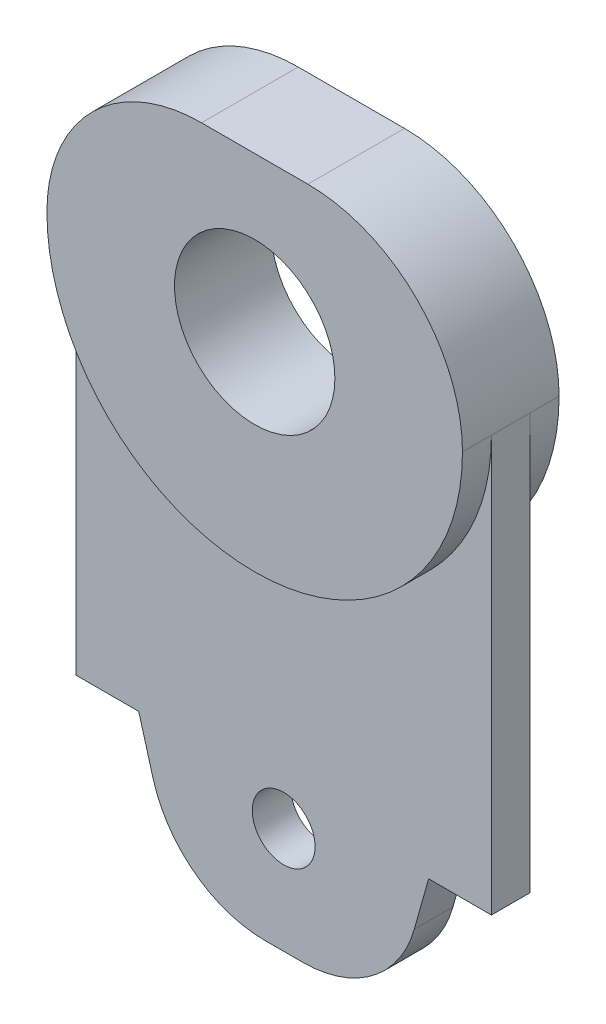
from build123d import *

# Parameters (mm, degrees)
ESQUISSE1_R             = 4.15
ESQUISSE1_R_2           = 1.625
BOSS_EXTRU_1_DEPTH      = 2
SALIENTE_EXTRUIR1_START = -1.5
CROQUIS1_R              = 4.15
SALIENTE_EXTRUIR1_DEPTH = 1.5


with BuildPart() as part:
    # Esquisse1 → Boss.-Extru.1 (new body)
    with BuildSketch(Plane.XY):
        with BuildLine():
            Line((3.25, 0), (3.991824339, -2.629250822))
            ThreePointArc((3.991824339, -2.629250822), (6.145300464, -5.784114596), (9.766384215, -7))
            Line((9.766384215, -7), (11.733615785, -7))
            ThreePointArc((11.733615785, -7), (15.354699536, -5.784114596), (17.508175661, -2.629250822))
            Line((17.508175661, -2.629250822), (18.25, 0))
            Line((18.25, 0), (21.5, 0))
            Line((21.5, 0), (21.5, 21.5))
            ThreePointArc((21.5, 21.5), (19.156854249, 27.156854249), (13.5, 29.5))
            Line((13.5, 29.5), (8, 29.5))
            ThreePointArc((8, 29.5), (2.343145751, 27.156854249), (0, 21.5))
            Line((0, 21.5), (0, 0))
            Line((0, 0), (3.25, 0))
        make_face()
        with Locations((10.75, 21.5)):
            Circle(ESQUISSE1_R, mode=Mode.SUBTRACT)
        with Locations((10.75, -1.5)):
            Circle(ESQUISSE1_R_2, mode=Mode.SUBTRACT)
    extrude(amount=BOSS_EXTRU_1_DEPTH)

    # Croquis1 → Saliente-Extruir1 (add)
    with BuildSketch(Plane.XY.offset(SALIENTE_EXTRUIR1_START)):
        with BuildLine():
            ThreePointArc((0, 21.5), (3.148602144, 13.898602061), (10.750000117, 10.75))
            ThreePointArc((10.750000117, 10.75), (18.351397939, 13.898602144), (21.5, 21.5))
            ThreePointArc((21.5, 21.5), (19.156854249, 27.156854249), (13.5, 29.5))
            Line((13.5, 29.5), (8, 29.5))
            ThreePointArc((8, 29.5), (2.343145751, 27.156854249), (0, 21.5))
        make_face()
        with Locations((10.75, 21.5)):
            Circle(CROQUIS1_R, mode=Mode.SUBTRACT)
    saliente_extruir1 = extrude(amount=SALIENTE_EXTRUIR1_DEPTH)

    # Simetría1: Saliente-Extruir1 across plane
    add(saliente_extruir1.mirror(Plane(origin=(0, 0, 1), x_dir=(1, 0, 0), z_dir=(0, 0, -1))))


solid = part.part
